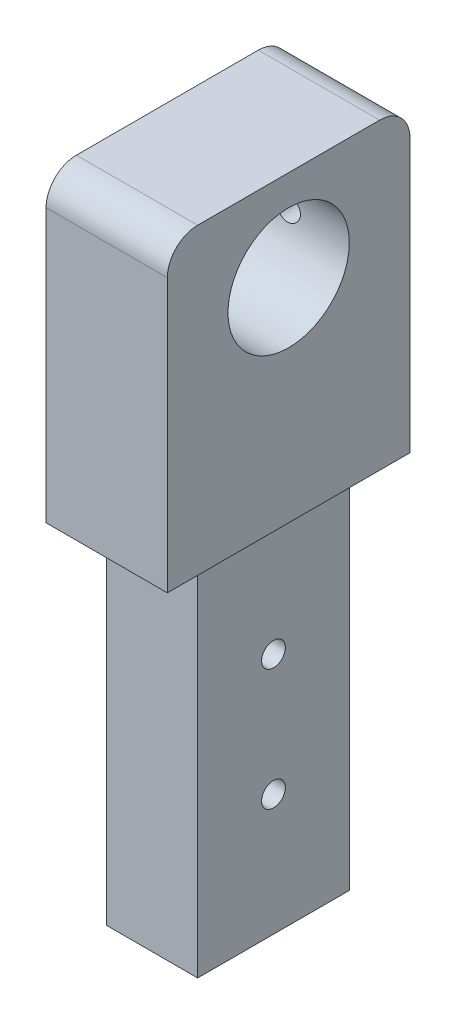
from build123d import *

# Parameters (mm, degrees)
SKETCH2_W               = 19.05
SKETCH2_H               = 31.75
BOSS_EXTRUDE1_DEPTH     = 76.2
SKETCH3_W               = 25.4
SKETCH3_H               = 50.8
BOSS_EXTRUDE2_DEPTH     = 63.5
FILLET1_R               = 6.35
SKETCH4_R               = 12.7
CUT_EXTRUDE1_DEPTH      = 145.244271983
CUT_EXTRUDE2_REACH      = 151.191
CUT_EXTRUDE2_END_RADIUS = 12.7
SKETCH5_R               = 2.4892
CUT_EXTRUDE3_REACH      = 145.719
SKETCH6_R               = 2.4892


with BuildPart() as part:
    # Sketch2 → Boss-Extrude1 (new body)
    with BuildSketch(Plane(origin=(0, 0, 0), x_dir=(1, 0, 0), z_dir=(0, 1, 0))):
        Rectangle(SKETCH2_W, SKETCH2_H)
    extrude(amount=BOSS_EXTRUDE1_DEPTH)

    # Sketch3 → Boss-Extrude2 (add)
    with BuildSketch(Plane(origin=(0, 76.2, 0), x_dir=(1, 0, 0), z_dir=(0, 1, 0))):
        Rectangle(SKETCH3_W, SKETCH3_H)
    extrude(amount=BOSS_EXTRUDE2_DEPTH)

    # Fillet1
    fillet1_edges = [part.edges().sort_by_distance(p)[0] for p in [
        (0, 139.7, -25.4),
        (0, 139.7, 25.4),
    ]]
    fillet(fillet1_edges, radius=FILLET1_R)

    # Sketch4 → Cut-Extrude1 (cut, through all)
    with BuildSketch(Plane(origin=(12.7, 0, 0), x_dir=(0, 0, -1), z_dir=(1, 0, 0))):
        with Locations((0, 120.65)):
            Circle(SKETCH4_R)
    extrude(amount=-CUT_EXTRUDE1_DEPTH, mode=Mode.SUBTRACT)

    # Cut-Extrude2: up to this cylinder (the profile starts outside it)
    cut_extrude2_end = Plane(origin=(0, 120.65, 0), z_dir=(1, 0, 0)) * Cylinder(CUT_EXTRUDE2_END_RADIUS, 328.782, mode=Mode.PRIVATE)
    # Sketch5 → Cut-Extrude2 (cut, up to the surface)
    with BuildSketch(Plane(origin=(0, 0, -25.4), x_dir=(-1, 0, 0), z_dir=(0, 0, -1)), mode=Mode.PRIVATE) as cut_extrude2_sk1:
        with Locations((0, 120.65)):
            Circle(SKETCH5_R)
    cut_extrude2_tool1 = extrude(cut_extrude2_sk1.sketch, amount=-CUT_EXTRUDE2_REACH, mode=Mode.PRIVATE) - cut_extrude2_end
    add(cut_extrude2_tool1.solids().sort_by_distance((0, 120.65, -25.4))[0], mode=Mode.SUBTRACT)

    # Sketch6 → Cut-Extrude3 (cut, up to next)
    with BuildSketch(Plane.ZY.offset(9.525), mode=Mode.PRIVATE) as cut_extrude3_sk1:
        with Locations((0, 25.4)):
            Circle(SKETCH6_R)
    cut_extrude3_tool1 = extrude(cut_extrude3_sk1.sketch, amount=-CUT_EXTRUDE3_REACH, mode=Mode.PRIVATE) & part.part
    # Sketch6 → Cut-Extrude3 (cut, up to next)
    with BuildSketch(Plane.ZY.offset(9.525), mode=Mode.PRIVATE) as cut_extrude3_sk2:
        with Locations((0, 50.8)):
            Circle(SKETCH6_R)
    cut_extrude3_tool2 = extrude(cut_extrude3_sk2.sketch, amount=-CUT_EXTRUDE3_REACH, mode=Mode.PRIVATE) & part.part
    add(cut_extrude3_tool1.solids().sort_by_distance((-9.525, 25.4, 0))[0], mode=Mode.SUBTRACT)
    add(cut_extrude3_tool2.solids().sort_by_distance((-9.525, 50.8, 0))[0], mode=Mode.SUBTRACT)


solid = part.part
